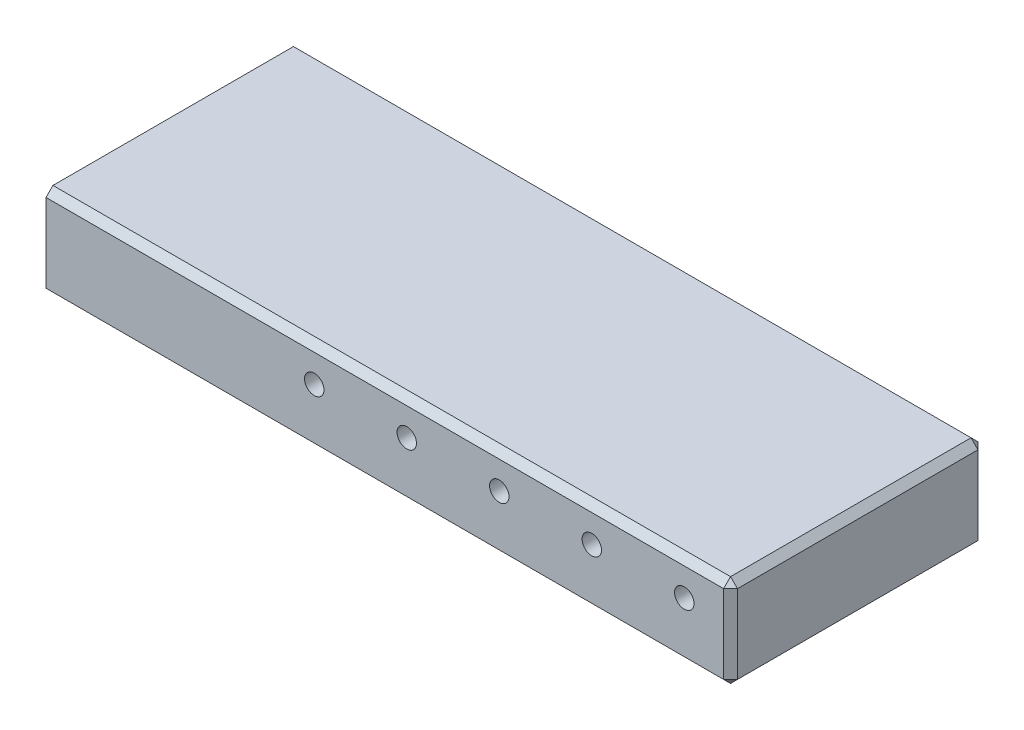
from build123d import *

# Parameters (mm, degrees)
BOSS_EXTRUDE1_DEPTH        = 55
SKETCH2_W                  = 5
SKETCH2_H                  = 70
BOSS_EXTRUDE2_DEPTH        = 5
M5_TAPPED_HOLE1_AT_2_COUNT = 2
M5_TAPPED_HOLE1_AT_2_PITCH = 20
M5_TAPPED_HOLE1_AT_3_COUNT = 2
M5_TAPPED_HOLE1_AT_3_PITCH = 40
M5_TAPPED_HOLE1_AT_4_COUNT = 2
M5_TAPPED_HOLE1_AT_4_PITCH = 60
M5_TAPPED_HOLE1_AT_5_COUNT = 2
M5_TAPPED_HOLE1_AT_5_PITCH = 80
CUT_EXTRUDE1_DEPTH         = 126
SKETCH9_W                  = 55
SKETCH9_H                  = 20
BOSS_EXTRUDE3_DEPTH        = 5
CHAMFER1_SIZE              = 1.5
BOSS_EXTRUDE4_DEPTH        = 50
M6_TAPPED_HOLE2_D          = 5
M6_TAPPED_HOLE2_DEPTH      = 23.497848452
M6_TAPPED_HOLE2_TIP        = 1.502151548


with BuildPart() as part:
    # Sketch1 → Boss-Extrude1 (new body)
    with BuildSketch(Plane.XY):
        Polygon((0, 0), (110, 0), (110, 20), (20, 20), (20, 70), (0, 70), align=None)
    extrude(amount=BOSS_EXTRUDE1_DEPTH)

    # Sketch2 → Boss-Extrude2 (add)
    with BuildSketch(Plane.ZY):
        with Locations((52.5, 35)):
            Rectangle(SKETCH2_W, SKETCH2_H)
        with Locations((2.5, 35)):
            Rectangle(SKETCH2_W, SKETCH2_H)
    extrude(amount=BOSS_EXTRUDE2_DEPTH)

    # Sketch4 → M5 Tapped Hole1 (revolve, cut)
    with BuildSketch(Plane(origin=(100, 12.5, 55), x_dir=(0, -1, 0), z_dir=(1, 0, 0))):
        Polygon((0, 0), (0, 15.2618073), (2.1, 14), (2.1, 0), align=None)
    m5_tapped_hole1 = revolve(axis=Axis((100, 12.5, 61.35), (0, 0, -1)), mode=Mode.SUBTRACT)

    # M5 Tapped Hole1 at 2: M5 Tapped Hole1 ×2
    with Locations(*[(-i * M5_TAPPED_HOLE1_AT_2_PITCH, 0, 0) for i in range(1, M5_TAPPED_HOLE1_AT_2_COUNT)]):
        add(m5_tapped_hole1, mode=Mode.SUBTRACT)

    # M5 Tapped Hole1 at 3: M5 Tapped Hole1 ×2
    with Locations(*[(-i * M5_TAPPED_HOLE1_AT_3_PITCH, 0, 0) for i in range(1, M5_TAPPED_HOLE1_AT_3_COUNT)]):
        add(m5_tapped_hole1, mode=Mode.SUBTRACT)

    # M5 Tapped Hole1 at 4: M5 Tapped Hole1 ×2
    with Locations(*[(-i * M5_TAPPED_HOLE1_AT_4_PITCH, 0, 0) for i in range(1, M5_TAPPED_HOLE1_AT_4_COUNT)]):
        add(m5_tapped_hole1, mode=Mode.SUBTRACT)

    # M5 Tapped Hole1 at 5: M5 Tapped Hole1 ×2
    with Locations(*[(-i * M5_TAPPED_HOLE1_AT_5_PITCH, 0, 0) for i in range(1, M5_TAPPED_HOLE1_AT_5_COUNT)]):
        add(m5_tapped_hole1, mode=Mode.SUBTRACT)

    # Mirror1: M5 Tapped Hole1 across plane
    add(m5_tapped_hole1.mirror(Plane.XY.offset(27.5)), mode=Mode.SUBTRACT)

    # Mirror1 copy 1 sketch → Mirror1 copy 1 (revolve, cut)
    with BuildSketch(Plane(origin=(80, 12.5, 0), x_dir=(0, -1, 0), z_dir=(1, 0, 0))):
        Polygon((0, 0), (0, -15.2618073), (2.1, -14), (2.1, 0), align=None)
    revolve(axis=Axis((80, 12.5, -6.35), (0, 0, -1)), mode=Mode.SUBTRACT)

    # Mirror1 copy 2 sketch → Mirror1 copy 2 (revolve, cut)
    with BuildSketch(Plane(origin=(60, 12.5, 0), x_dir=(0, -1, 0), z_dir=(1, 0, 0))):
        Polygon((0, 0), (0, -15.2618073), (2.1, -14), (2.1, 0), align=None)
    revolve(axis=Axis((60, 12.5, -6.35), (0, 0, -1)), mode=Mode.SUBTRACT)

    # Mirror1 copy 3 sketch → Mirror1 copy 3 (revolve, cut)
    with BuildSketch(Plane(origin=(40, 12.5, 0), x_dir=(0, -1, 0), z_dir=(1, 0, 0))):
        Polygon((0, 0), (0, -15.2618073), (2.1, -14), (2.1, 0), align=None)
    revolve(axis=Axis((40, 12.5, -6.35), (0, 0, -1)), mode=Mode.SUBTRACT)

    # Mirror1 copy 4 sketch → Mirror1 copy 4 (revolve, cut)
    with BuildSketch(Plane(origin=(20, 12.5, 0), x_dir=(0, -1, 0), z_dir=(1, 0, 0))):
        Polygon((0, 0), (0, -15.2618073), (2.1, -14), (2.1, 0), align=None)
    revolve(axis=Axis((20, 12.5, -6.35), (0, 0, -1)), mode=Mode.SUBTRACT)

    # Sketch8 → Cut-Extrude1 (cut)
    with BuildSketch(Plane.XY.offset(55)):
        Polygon((17, 20), (17, 0), (-5, 0), (-5, 70), (20, 70), (20, 20), align=None)
    extrude(amount=-CUT_EXTRUDE1_DEPTH, mode=Mode.SUBTRACT)

    # Sketch9 → Boss-Extrude3 (add)
    with BuildSketch(Plane.ZY.offset(-17)):
        with Locations((27.5, 10)):
            Rectangle(SKETCH9_W, SKETCH9_H)
    extrude(amount=BOSS_EXTRUDE3_DEPTH)

    # Chamfer1
    chamfer1_edges = [part.edges().sort_by_distance(p)[0] for p in [
        (110, 20, 27.5),
        (110, 0, 27.5),
        (110, 10, 55),
        (61, 20, 55),
        (61, 20, 0),
        (110, 10, 0),
        (61, 0, 0),
        (61, 0, 55),
    ]]
    chamfer(chamfer1_edges, length=CHAMFER1_SIZE)

    # Sketch10 → Boss-Extrude4 (add)
    with BuildSketch(Plane.ZY.offset(-12)):
        Polygon((0, 18.5), (1.5, 20), (53.5, 20), (55, 18.5), (55, 1.5), (53.5, 0), (1.5, 0), (0, 1.5), align=None)
    extrude(amount=BOSS_EXTRUDE4_DEPTH)

    # M6 Tapped Hole2
    with Locations(Plane.ZY.offset(38)):
        with Locations((15, 10), (40, 10)):
            Hole(M6_TAPPED_HOLE2_D / 2, depth=M6_TAPPED_HOLE2_DEPTH)
            with Locations((0, 0, -(M6_TAPPED_HOLE2_DEPTH + M6_TAPPED_HOLE2_TIP / 2))):  # 118° drill point
                Cone(0, M6_TAPPED_HOLE2_D / 2, M6_TAPPED_HOLE2_TIP, mode=Mode.SUBTRACT)


solid = part.part
